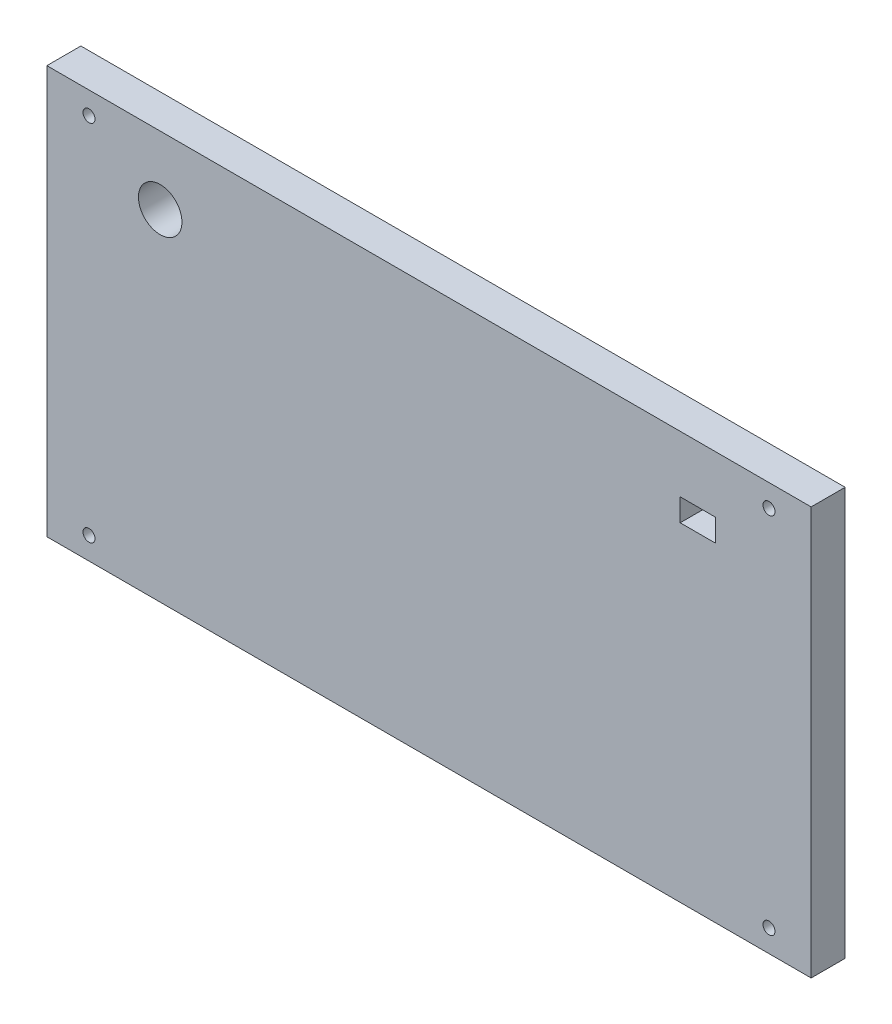
from build123d import *

# Parameters (mm, degrees)
SKETCH1_W           = 428.225
SKETCH1_H           = 228.6
SKETCH1_R           = 3.3655
SKETCH1_R_2         = 12.192
BOSS_EXTRUDE1_DEPTH = 19.05
SKETCH2_W           = 19.75
SKETCH2_H           = 12.6
CUT_EXTRUDE1_DEPTH  = 449.470305943


with BuildPart() as part:
    # Sketch1 → Boss-Extrude1 (new body)
    with BuildSketch(Plane.XY):
        with Locations((190.5, 78.1875)):
            Rectangle(SKETCH1_W, SKETCH1_H)
        with Locations(Location((0, -23.6125, 0), (0, 0, 180))):
            Circle(SKETCH1_R, mode=Mode.SUBTRACT)
        with Locations(Location((381, -23.6125, 0), (0, 0, 180))):
            Circle(SKETCH1_R, mode=Mode.SUBTRACT)
        with Locations(Location((381, 179.9875, 0), (0, 0, 180))):
            Circle(SKETCH1_R, mode=Mode.SUBTRACT)
        with Locations(Location((0, 179.9875, 0), (0, 0, 180))):
            Circle(SKETCH1_R, mode=Mode.SUBTRACT)
        with Locations(Location((39.8875, 154.3875, 0), (0, 0, 180))):
            Circle(SKETCH1_R_2, mode=Mode.SUBTRACT)
    extrude(amount=BOSS_EXTRUDE1_DEPTH)

    # Sketch2 → Cut-Extrude1 (cut, through all)
    with BuildSketch(Plane.XY.offset(19.05)):
        with Locations((341.1125, 154.3875)):
            Rectangle(SKETCH2_W, SKETCH2_H)
    extrude(amount=-CUT_EXTRUDE1_DEPTH, mode=Mode.SUBTRACT)


solid = part.part
